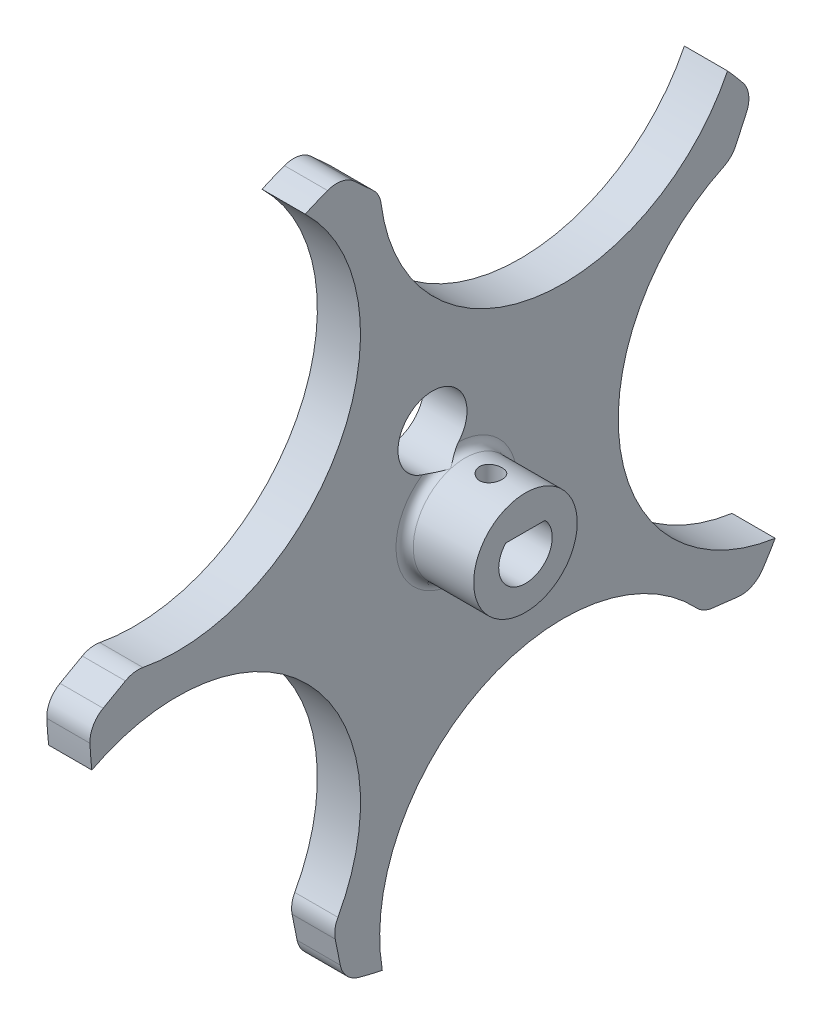
from build123d import *

# Parameters (mm, degrees)
EXTRUDE_2_DEPTH     = 2.5
SKETCH_4_R          = 6
EXTRUDE_3_DEPTH     = 8
CUT_EXTRUDE_5_DEPTH = 11.5
SKETCH_14_R         = 1.6
CUT_EXTRUDE_6_DEPTH = 12
SKETCH_15_R         = 1.3
CUT_EXTRUDE_7_DEPTH = 11
FILLET_7_R          = 1
FILLET1_R           = 3
SKETCH1_R           = 4
CUT_EXTRUDE2_DEPTH  = 50


with BuildPart() as part:
    # 草图2 → 凸台-拉伸2 (new, symmetric)
    with BuildSketch(Plane.ZY.offset(38.091621509)):
        with BuildLine():
            Line((55.24762265, 27.512579341), (50.911357014, 23.516558631))
            ThreePointArc((50.911357014, 23.516558631), (33.760797652, 4.281653093), (10.672961639, 15.730456776))
            ThreePointArc((10.672961639, 15.730456776), (9.146547949, 13.960204765), (7.719768364, 12.108710517))
            Line((7.719768364, 12.108710517), (10.180230126, 6.749838518))
            ThreePointArc((10.180230126, 6.749838518), (23.173898072, -15.505225418), (5.150905034, -33.925187402))
            ThreePointArc((5.150905034, -33.925187402), (6.362826974, -35.923931044), (7.682803504, -37.853022253))
            Line((7.682803504, -37.853022253), (13.539718137, -37.16896658))
            ThreePointArc((13.539718137, -37.16896658), (38.720805929, -31.688446976), (50.669819665, -54.521413236))
            ThreePointArc((50.669819665, -54.521413236), (52.945242306, -53.986452731), (55.187812251, -53.327202418))
            Line((55.187812251, -53.327202418), (56.347122801, -47.545560763))
            ThreePointArc((56.347122801, -47.545560763), (58.916222984, -21.903349436), (84.324112643, -17.594936665))
            ThreePointArc((84.324112643, -17.594936665), (84.518479234, -15.265569248), (84.584487152, -12.929038938))
            Line((84.584487152, -12.929038938), (79.444065843, -10.039843558))
            ThreePointArc((79.444065843, -10.039843558), (55.850769285, 0.327394986), (59.60469494, 25.823106776))
            ThreePointArc((59.60469494, 25.823106776), (57.449397458, 26.727774506), (55.24762265, 27.512579341))
        make_face()
    extrude(amount=EXTRUDE_2_DEPTH, both=True)

    # 草图4 → 凸台-拉伸3 (add)
    with BuildSketch(Plane(origin=(-35.591621509, 0, 0), x_dir=(0, 0, -1), z_dir=(1, 0, 0))):
        with Locations((-42.084498784, -12.89759475)):
            Circle(SKETCH_4_R)
    extrude(amount=EXTRUDE_3_DEPTH)

    # 草图13 → 切除-拉伸5 (cut)
    with BuildSketch(Plane(origin=(-27.591621509, 0, 0), x_dir=(0, 0, -1), z_dir=(1, 0, 0))):
        with BuildLine():
            Line((-44.364849634, -10.79759475), (-39.804147934, -10.79759475))
            ThreePointArc((-39.804147934, -10.79759475), (-42.084498784, -15.99759475), (-44.364849634, -10.79759475))
        make_face()
    extrude(amount=-CUT_EXTRUDE_5_DEPTH, mode=Mode.SUBTRACT)

    # 草图14 → 切除-拉伸6 (cut)
    with BuildSketch(Plane.ZY.offset(40.591621509)):
        with Locations((42.084498784, -12.89759475)):
            Circle(SKETCH_14_R)
    extrude(amount=-CUT_EXTRUDE_6_DEPTH, mode=Mode.SUBTRACT)

    # 草图15 → 切除-拉伸7 (cut)
    with BuildSketch(Plane.XZ.offset(10.79759475)):
        with Locations((-31.591621509, 42.084498784)):
            Circle(SKETCH_15_R)
    extrude(amount=-CUT_EXTRUDE_7_DEPTH, mode=Mode.SUBTRACT)

    # 圆角7
    fillet_7_edges = [part.edges().sort_by_distance(p)[0] for p in [
        (-35.591621509, -12.89759475, 48.084498784),
    ]]
    fillet(fillet_7_edges, radius=FILLET_7_R)

    # Fillet1
    fillet1_edges = [part.edges().sort_by_distance(p)[0] for p in [
        (-38.091621509, -47.545560763, 56.347122801),
        (-38.091621509, -53.327202418, 55.187812251),
        (-38.091621509, -37.853022253, 7.682803504),
        (-38.091621509, -37.16896658, 13.539718137),
        (-38.091621509, 6.749838518, 10.180230126),
        (-38.091621509, 12.108710517, 7.719768364),
        (-38.091621509, -12.929038938, 84.584487152),
        (-38.091621509, -10.039843558, 79.444065843),
        (-38.091621509, 27.512579341, 55.24762265),
        (-38.091621509, 23.516558631, 50.911357014),
    ]]
    fillet(fillet1_edges, radius=FILLET1_R)

    # Sketch1 → Cut-Extrude2 (cut)
    with BuildSketch(Plane.ZY.offset(40.591621509)):
        with Locations((44.856906438, -3.289589973)):
            Circle(SKETCH1_R)
    extrude(amount=-CUT_EXTRUDE2_DEPTH, mode=Mode.SUBTRACT)


solid = part.part
